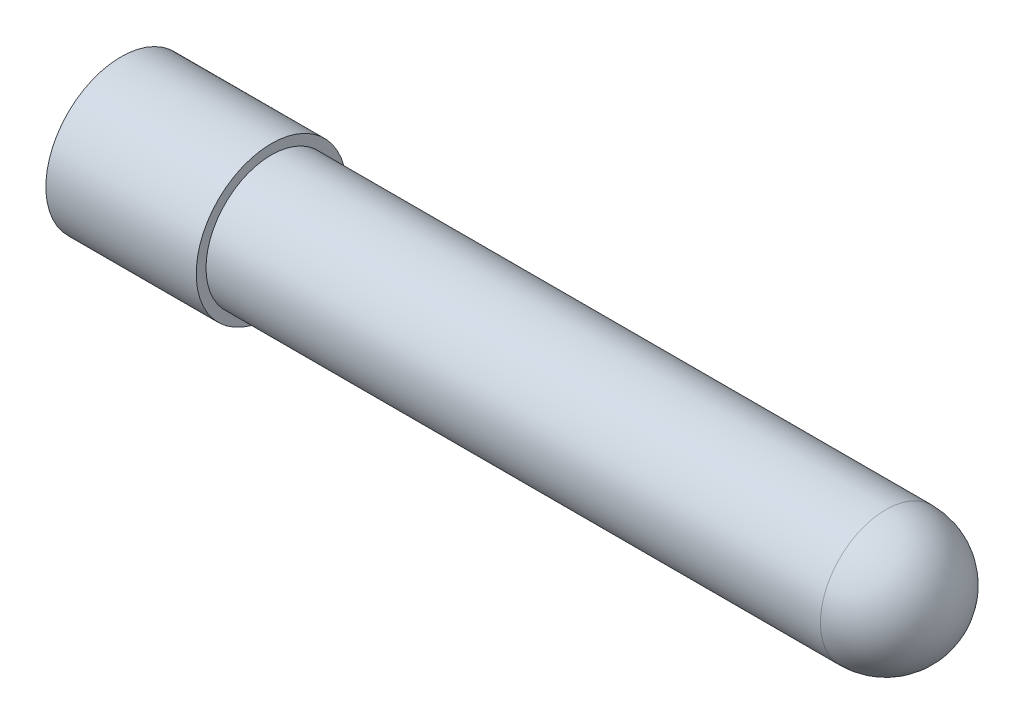
from build123d import *

# Parameters (mm, degrees)
SKETCH_1_R          = 5.75
EXTRUDE_1_DEPTH     = 11.5
SKETCH_3_R          = 5
EXTRUDE_2_DEPTH     = 63.5
FILLET_1_R          = 5
SKETCH_4_R          = 3
CUT_EXTRUDE_1_DEPTH = 4


with BuildPart() as part:
    # 草图1 → 凸台-拉伸1 (new body)
    with BuildSketch(Plane(origin=(0, 0, 0), x_dir=(0, 0, -1), z_dir=(1, 0, 0))):
        Circle(SKETCH_1_R)
    extrude(amount=EXTRUDE_1_DEPTH)

    # 草图3 → 凸台-拉伸2 (add)
    with BuildSketch(Plane.ZY):
        Circle(SKETCH_3_R)
    extrude(amount=-EXTRUDE_2_DEPTH)

    # 圆角1
    fillet_1_edges = [part.edges().sort_by_distance(p)[0] for p in [
        (63.5, 0, -5),
    ]]
    fillet(fillet_1_edges, radius=FILLET_1_R)

    # 草图4 → 切除-拉伸1 (cut)
    with BuildSketch(Plane.ZY):
        Circle(SKETCH_4_R)
    extrude(amount=-CUT_EXTRUDE_1_DEPTH, mode=Mode.SUBTRACT)


solid = part.part
